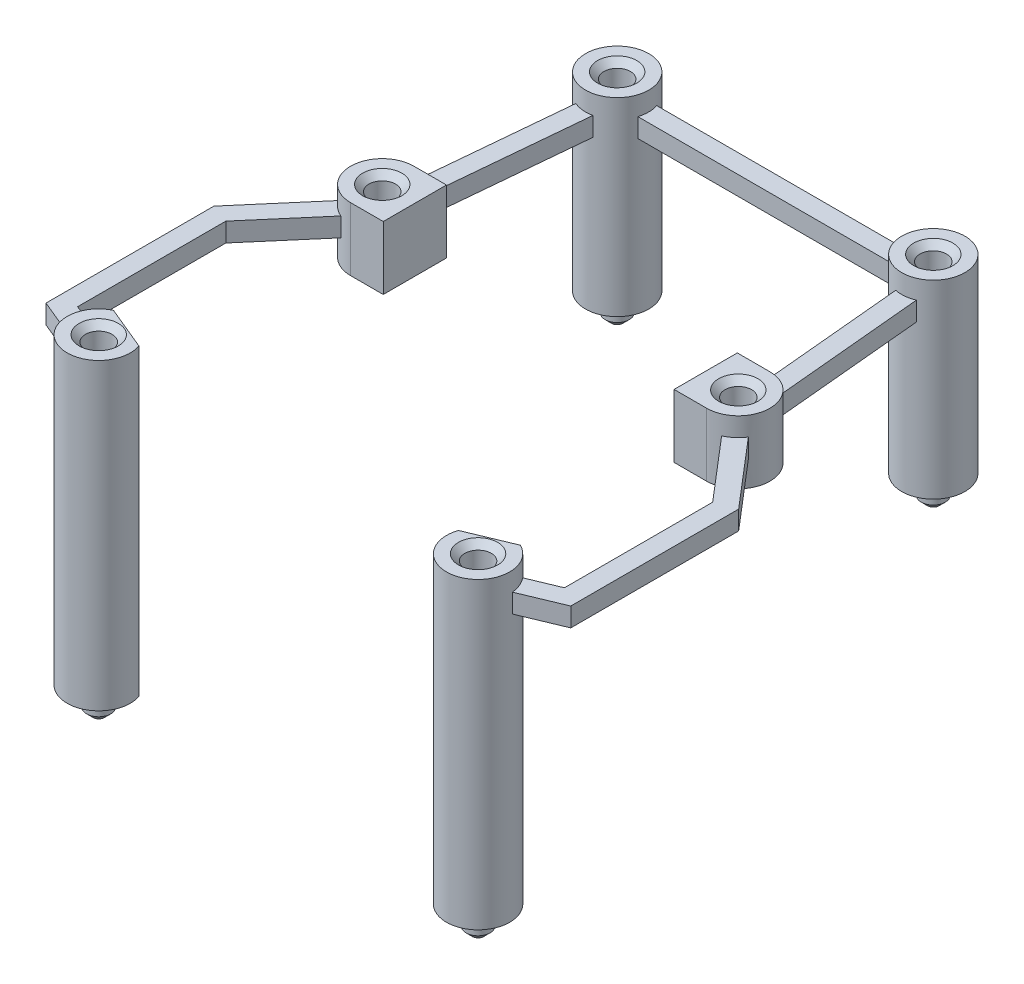
from build123d import *

# Parameters (mm, degrees)
SKETCH_1_R               = 5
EXTRUDE_1_DEPTH          = 30
EXTRUDE_1_2_DEPTH        = 30
EXTRUDE_1_3_DEPTH        = 30
EXTRUDE_1_4_DEPTH        = 30
EXTRUDE_START            = 18
SKETCH_2_R               = 5
EXTRUDE_2_DEPTH          = 18
SKETCH_3_R               = 2.1
CUT_EXTRUDE_1_DEPTH      = 5
EXTRUDE_START_2          = 20
EXTRUDE_3_DEPTH          = 10
EXTRUDE_3_2_DEPTH        = 10
CUT_EXTRUDE_2_DEPTH      = 102.257098517
CUT_EXTRUDE_2_DEPTH_BACK = 102.257098517
EXTRUDE_START_3          = -3
EXTRUDE_4_DEPTH          = 3
SKETCH_7_R               = 2.1
CUT_EXTRUDE_3_DEPTH      = 5
SKETCH_8_R               = 1.9
EXTRUDE_5_DEPTH          = 4
SKETCH_9_R               = 1.9
EXTRUDE_6_DEPTH          = 4
CHAMFER_1_SIZE           = 1


with BuildPart() as part:
    # 스케치1 → 보스-돌출1 (new body)
    with BuildSketch(Plane(origin=(0, 0, 0), x_dir=(1, 0, 0), z_dir=(0, 1, 0))):
        with Locations((30, 0)):
            Circle(SKETCH_1_R)
    extrude(amount=EXTRUDE_1_DEPTH)



with BuildPart() as body_2:
    # 스케치1 → Extrude 1 2 (new body)
    with BuildSketch(Plane(origin=(0, 0, 0), x_dir=(1, 0, 0), z_dir=(0, 1, 0))):
        with Locations((25, 77)):
            Circle(SKETCH_1_R)
    extrude(amount=EXTRUDE_1_2_DEPTH)


with BuildPart() as body_3:
    # 스케치1 → Extrude 1 3 (new body)
    with BuildSketch(Plane(origin=(0, 0, 0), x_dir=(1, 0, 0), z_dir=(0, 1, 0))):
        with Locations((-30, 0)):
            Circle(SKETCH_1_R)
    extrude(amount=EXTRUDE_1_3_DEPTH)


with BuildPart() as body_4:
    # 스케치1 → Extrude 1 4 (new body)
    with BuildSketch(Plane(origin=(0, 0, 0), x_dir=(1, 0, 0), z_dir=(0, 1, 0))):
        with Locations((-25, 77)):
            Circle(SKETCH_1_R)
    extrude(amount=EXTRUDE_1_4_DEPTH)


with BuildPart() as part_1:
    add(part.part)

    add(body_3.part)  # 보스-돌출2 merges body 3
    # 스케치2 → 보스-돌출2 (add)
    with BuildSketch(Plane.XZ.offset(EXTRUDE_START)):
        with Locations((-30, 0)):
            Circle(SKETCH_2_R)
        with Locations((30, 0)):
            Circle(SKETCH_2_R)
    extrude(amount=-EXTRUDE_2_DEPTH)

    # 스케치5 → 컷-돌출2 (cut, two sides: drawn at the far end of the back side and taken through both)
    with BuildSketch(Plane(origin=(0, 30, 0), x_dir=(1, 0, 0), z_dir=(0, 1, 0)).offset(-CUT_EXTRUDE_2_DEPTH_BACK)):
        with BuildLine():
            Line((-32.175491387, 4.50191484), (-25.273954776, 1.632328565))
            ThreePointArc((-25.273954776, 1.632328565), (-28.080374368, 4.61682114), (-32.175491387, 4.50191484))
        make_face()
        with BuildLine():
            Line((25.273954776, 1.632328565), (32.175491387, 4.50191484))
            ThreePointArc((32.175491387, 4.50191484), (28.080374368, 4.61682114), (25.273954776, 1.632328565))
        make_face()
    extrude(amount=CUT_EXTRUDE_2_DEPTH + CUT_EXTRUDE_2_DEPTH_BACK, mode=Mode.SUBTRACT)



with BuildPart() as cut_extrude_1_tool:
    # 스케치3 → 컷-돌출1 (new body)
    with BuildSketch(Plane(origin=(0, 30, 0), x_dir=(1, 0, 0), z_dir=(0, 1, 0))):
        with Locations((-25, 77)):
            Circle(SKETCH_3_R)
        with Locations((25, 77)):
            Circle(SKETCH_3_R)
    extrude(amount=-CUT_EXTRUDE_1_DEPTH)


with BuildPart() as body_2_1:
    add(body_2.part)

    # 컷-돌출1: cut by cut_extrude_1_tool
    add(cut_extrude_1_tool.part, mode=Mode.SUBTRACT)


with BuildPart() as body_4_1:
    add(body_4.part)

    # 컷-돌출1: cut by cut_extrude_1_tool
    add(cut_extrude_1_tool.part, mode=Mode.SUBTRACT)


with BuildPart() as body_4_2:
    # 스케치4 → 보스-돌출3 (new body)
    with BuildSketch(Plane(origin=(0, 0, 0), x_dir=(1, 0, 0), z_dir=(0, 1, 0)).offset(EXTRUDE_START_2)):
        with BuildLine():
            Line((23, 48), (28.159807037, 48))
            ThreePointArc((28.159807037, 48), (33.159807037, 43), (28.159807037, 38))
            Line((28.159807037, 38), (23, 38))
            Line((23, 38), (23, 48))
        make_face()
    extrude(amount=EXTRUDE_3_DEPTH)


with BuildPart() as body_5:
    # 스케치4 → Extrude 3 2 (new body)
    with BuildSketch(Plane(origin=(0, 0, 0), x_dir=(1, 0, 0), z_dir=(0, 1, 0)).offset(EXTRUDE_START_2)):
        with BuildLine():
            Line((-23, 48), (-28.159807037, 48))
            ThreePointArc((-28.159807037, 48), (-33.159807037, 43), (-28.159807037, 38))
            Line((-28.159807037, 38), (-23, 38))
            Line((-23, 38), (-23, 48))
        make_face()
    extrude(amount=EXTRUDE_3_2_DEPTH)


with BuildPart() as part_2:
    add(part_1.part)

    add(body_2_1.part)  # 보스-돌출4 merges body 2

    add(body_4_1.part)  # 보스-돌출4 merges body 4

    add(body_4_2.part)  # 보스-돌출4 merges body 4 2

    add(body_5.part)  # 보스-돌출4 merges body 5
    # 스케치6 → 보스-돌출4 (add)
    with BuildSketch(Plane(origin=(0, 30, 0), x_dir=(1, 0, 0), z_dir=(0, 1, 0)).offset(EXTRUDE_START_3)):
        Polygon((-29.42411231, 1.385046342), (-38.5, 5.158704907), (-38.5, 28.603878074), (-26.710319101, 42.386930811), (-23.632939423, 75.5), (23.632939423, 75.5), (26.710319101, 42.386930811), (38.5, 28.603878074), (38.5, 5.158704907), (29.42411231, 1.385046342), (30.57588769, -1.385046342), (41.5, 3.157084566), (41.5, 29.7119114), (29.609294973, 43.613069189), (26.367060577, 78.5), (-26.367060577, 78.5), (-29.609294973, 43.613069189), (-41.5, 29.7119114), (-41.5, 3.157084566), (-30.57588769, -1.385046342), align=None)
    extrude(amount=-EXTRUDE_4_DEPTH)

    # 스케치7 → 컷-돌출3 (cut)
    with BuildSketch(Plane(origin=(0, 30, 0), x_dir=(1, 0, 0), z_dir=(0, 1, 0))):
        with Locations((30, 0)):
            Circle(SKETCH_7_R)
        with Locations((-30, 0)):
            Circle(SKETCH_7_R)
        with Locations((28.159807037, 43)):
            Circle(SKETCH_7_R)
        with Locations((-28.159807037, 43)):
            Circle(SKETCH_7_R)
        with Locations((25, 77)):
            Circle(SKETCH_7_R)
        with Locations((-25, 77)):
            Circle(SKETCH_7_R)
    extrude(amount=-CUT_EXTRUDE_3_DEPTH, mode=Mode.SUBTRACT)

    # 스케치8 → 보스-돌출5 (add)
    with BuildSketch(Plane.XZ.offset(18)):
        with Locations((-30, 0)):
            Circle(SKETCH_8_R)
        with Locations((30, 0)):
            Circle(SKETCH_8_R)
    extrude(amount=EXTRUDE_5_DEPTH)

    # 스케치9 → 보스-돌출6 (add)
    with BuildSketch(Plane.XZ):
        with Locations((-25, -77)):
            Circle(SKETCH_9_R)
        with Locations((25, -77)):
            Circle(SKETCH_9_R)
    extrude(amount=EXTRUDE_6_DEPTH)

    # 모따기1
    chamfer_1_edges = [part_2.edges().sort_by_distance(p)[0] for p in [
        (28.1, -22, 0),
        (-31.9, -22, 0),
        (-26.9, -4, -77),
        (23.1, -4, -77),
        (22.9, 30, -77),
        (26.059807037, 30, -43),
        (27.9, 30, 0),
        (-32.1, 30, 0),
        (-30.259807037, 30, -43),
        (-27.1, 30, -77),
    ]]
    chamfer(chamfer_1_edges, length=CHAMFER_1_SIZE)


solid = part_2.part
